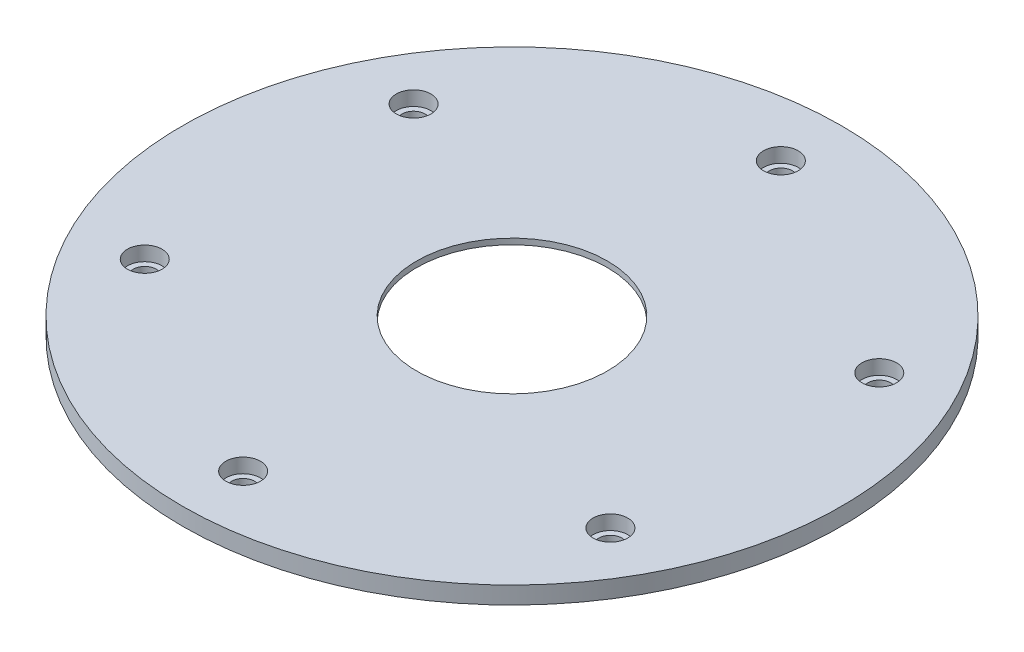
from build123d import *

# Parameters (mm, degrees)
SKETCH1_R           = 57
BOSS_EXTRUDE1_DEPTH = 3
SKETCH2_R           = 2
CUT_EXTRUDE1_DEPTH  = 81.665977958
CIRPATTERN1_COUNT   = 6
SKETCH5_R           = 3.25
BOSS_EXTRUDE2_DEPTH = 5
SKETCH4_R           = 16.5
CUT_EXTRUDE3_DEPTH  = 81.765091469
SKETCH8_R           = 2
CUT_EXTRUDE4_DEPTH  = 82.006172604
SKETCH9_R           = 3
CUT_EXTRUDE5_DEPTH  = 2.5
CUT_EXTRUDE7_DEPTH  = 2
CIRPATTERN3_COUNT   = 6
SKETCH12_R          = 25
SKETCH12_R_2        = 22.5
BOSS_EXTRUDE3_DEPTH = 2


with BuildPart() as part:
    # Sketch1 → Boss-Extrude1 (new body)
    with BuildSketch(Plane(origin=(0, 0, 0), x_dir=(1, 0, 0), z_dir=(0, 1, 0))):
        with Locations(Location((0, 0, 0), (0, 0, 270))):
            Circle(SKETCH1_R)
    extrude(amount=BOSS_EXTRUDE1_DEPTH)

    # Sketch2 → Cut-Extrude1 (cut, through all)
    with BuildSketch(Plane(origin=(0, 3, 0), x_dir=(1, 0, 0), z_dir=(0, 1, 0))):
        with Locations(Location((0, 46.5, 0), (0, 0, 270))):
            Circle(SKETCH2_R)
    cut_extrude1 = extrude(amount=-CUT_EXTRUDE1_DEPTH, mode=Mode.SUBTRACT)

    # CirPattern1: Cut-Extrude1 ×6 about axis
    cirpattern1_axis = Axis((0, 0, 0), (0, 1, 0))
    for i in range(1, CIRPATTERN1_COUNT):
        add(cut_extrude1.rotate(cirpattern1_axis, i * 360 / CIRPATTERN1_COUNT), mode=Mode.SUBTRACT)

    # Sketch5 → Boss-Extrude2 (add)
    with BuildSketch(Plane.XZ):
        with Locations(Location((0, 46.5, 0), (0, 0, 90))):
            Circle(SKETCH5_R)
        with Locations(Location((40.270181276, 23.25, 0), (0, 0, 90))):
            Circle(SKETCH5_R)
        with Locations(Location((40.270181276, -23.25, 0), (0, 0, 90))):
            Circle(SKETCH5_R)
        with Locations(Location((0, -46.5, 0), (0, 0, 90))):
            Circle(SKETCH5_R)
        with Locations(Location((-40.270181276, -23.25, 0), (0, 0, 90))):
            Circle(SKETCH5_R)
        with Locations(Location((-40.270181276, 23.25, 0), (0, 0, 90))):
            Circle(SKETCH5_R)
    extrude(amount=BOSS_EXTRUDE2_DEPTH)

    # Sketch4 → Cut-Extrude3 (cut, through all)
    with BuildSketch(Plane.XZ):
        with Locations(Location((0, 0, 0), (0, 0, 270))):
            Circle(SKETCH4_R)
    extrude(amount=-CUT_EXTRUDE3_DEPTH, mode=Mode.SUBTRACT)

    # Sketch8 → Cut-Extrude4 (cut, through all)
    with BuildSketch(Plane(origin=(0, 3, 0), x_dir=(1, 0, 0), z_dir=(0, 1, 0))):
        with Locations(Location((-40.270181276, -23.25, 0), (0, 0, 270))):
            Circle(SKETCH8_R)
        with Locations(Location((0, -46.5, 0), (0, 0, 270))):
            Circle(SKETCH8_R)
        with Locations(Location((40.270181276, -23.25, 0), (0, 0, 270))):
            Circle(SKETCH8_R)
        with Locations(Location((40.270181276, 23.25, 0), (0, 0, 270))):
            Circle(SKETCH8_R)
        with Locations(Location((0, 46.5, 0), (0, 0, 270))):
            Circle(SKETCH8_R)
        with Locations(Location((-40.270181276, 23.25, 0), (0, 0, 270))):
            Circle(SKETCH8_R)
    extrude(amount=-CUT_EXTRUDE4_DEPTH, mode=Mode.SUBTRACT)

    # Sketch9 → Cut-Extrude5 (cut)
    with BuildSketch(Plane(origin=(0, 3, 0), x_dir=(1, 0, 0), z_dir=(0, 1, 0))):
        with Locations(Location((-40.270181276, 23.25, 0), (0, 0, 270))):
            Circle(SKETCH9_R)
        with Locations(Location((0, 46.5, 0), (0, 0, 270))):
            Circle(SKETCH9_R)
        with Locations(Location((40.270181276, 23.25, 0), (0, 0, 270))):
            Circle(SKETCH9_R)
        with Locations(Location((40.270181276, -23.25, 0), (0, 0, 270))):
            Circle(SKETCH9_R)
        with Locations(Location((0, -46.5, 0), (0, 0, 270))):
            Circle(SKETCH9_R)
        with Locations(Location((-40.270181276, -23.25, 0), (0, 0, 270))):
            Circle(SKETCH9_R)
    extrude(amount=-CUT_EXTRUDE5_DEPTH, mode=Mode.SUBTRACT)

    # Sketch11 → Cut-Extrude7 (cut)
    with BuildSketch(Plane.XZ):
        with BuildLine():
            ThreePointArc((-50.023085711, 17.512592496), (-53, 0), (-50.023085711, -17.512592496))
            ThreePointArc((-50.023085711, -17.512592496), (-47.298125213, -20.050515589), (-43.662860234, -19.243476633))
            ThreePointArc((-43.662860234, -19.243476633), (-35.723547906, -20.625), (-38.496769739, -28.191407848))
            ThreePointArc((-38.496769739, -28.191407848), (-41.013318465, -30.936120192), (-40.177892843, -34.564966754))
            ThreePointArc((-40.177892843, -34.564966754), (-26.5, -45.899346401), (-9.845192868, -52.07755925))
            ThreePointArc((-9.845192868, -52.07755925), (-6.284806748, -50.98663578), (-5.166090495, -47.434884481))
            ThreePointArc((-5.166090495, -47.434884481), (0, -41.25), (5.166090495, -47.434884481))
            ThreePointArc((5.166090495, -47.434884481), (6.284806748, -50.98663578), (9.845192868, -52.07755925))
            ThreePointArc((9.845192868, -52.07755925), (26.5, -45.899346401), (40.177892843, -34.564966754))
            ThreePointArc((40.177892843, -34.564966754), (41.013318465, -30.936120192), (38.496769739, -28.191407848))
            ThreePointArc((38.496769739, -28.191407848), (35.723547906, -20.625), (43.662860234, -19.243476633))
            ThreePointArc((43.662860234, -19.243476633), (47.298125213, -20.050515589), (50.023085711, -17.512592496))
            ThreePointArc((50.023085711, -17.512592496), (53, 0), (50.023085711, 17.512592496))
            ThreePointArc((50.023085711, 17.512592496), (47.298125213, 20.050515589), (43.662860234, 19.243476633))
            ThreePointArc((43.662860234, 19.243476633), (35.723547906, 20.625), (38.496769739, 28.191407848))
            ThreePointArc((38.496769739, 28.191407848), (41.013318465, 30.936120192), (40.177892843, 34.564966754))
            ThreePointArc((40.177892843, 34.564966754), (26.5, 45.899346401), (9.845192868, 52.07755925))
            ThreePointArc((9.845192868, 52.07755925), (6.284806748, 50.98663578), (5.166090495, 47.434884481))
            ThreePointArc((5.166090495, 47.434884481), (0, 41.25), (-5.166090495, 47.434884481))
            ThreePointArc((-5.166090495, 47.434884481), (-6.284806748, 50.98663578), (-9.845192868, 52.07755925))
            ThreePointArc((-9.845192868, 52.07755925), (-26.5, 45.899346401), (-40.177892843, 34.564966754))
            ThreePointArc((-40.177892843, 34.564966754), (-41.013318465, 30.936120192), (-38.496769739, 28.191407848))
            ThreePointArc((-38.496769739, 28.191407848), (-35.723547906, 20.625), (-43.662860234, 19.243476633))
            ThreePointArc((-43.662860234, 19.243476633), (-47.298125213, 20.050515589), (-50.023085711, 17.512592496))
        make_face()
    cut_extrude7 = extrude(amount=-CUT_EXTRUDE7_DEPTH, mode=Mode.SUBTRACT)

    # CirPattern3: Cut-Extrude7 ×6 about axis
    cirpattern3_axis = Axis((0, 0, 0), (0, -1, 0))
    for i in range(1, CIRPATTERN3_COUNT):
        add(cut_extrude7.rotate(cirpattern3_axis, i * 360 / CIRPATTERN3_COUNT), mode=Mode.SUBTRACT)

    # Sketch12 → Boss-Extrude3 (add)
    with BuildSketch(Plane.XZ.offset(-2)):
        with Locations(Location((0, 0, 0), (0, 0, 270))):
            Circle(SKETCH12_R)
        with Locations(Location((0, 0, 0), (0, 0, 270))):
            Circle(SKETCH12_R_2, mode=Mode.SUBTRACT)
    extrude(amount=BOSS_EXTRUDE3_DEPTH)


solid = part.part
